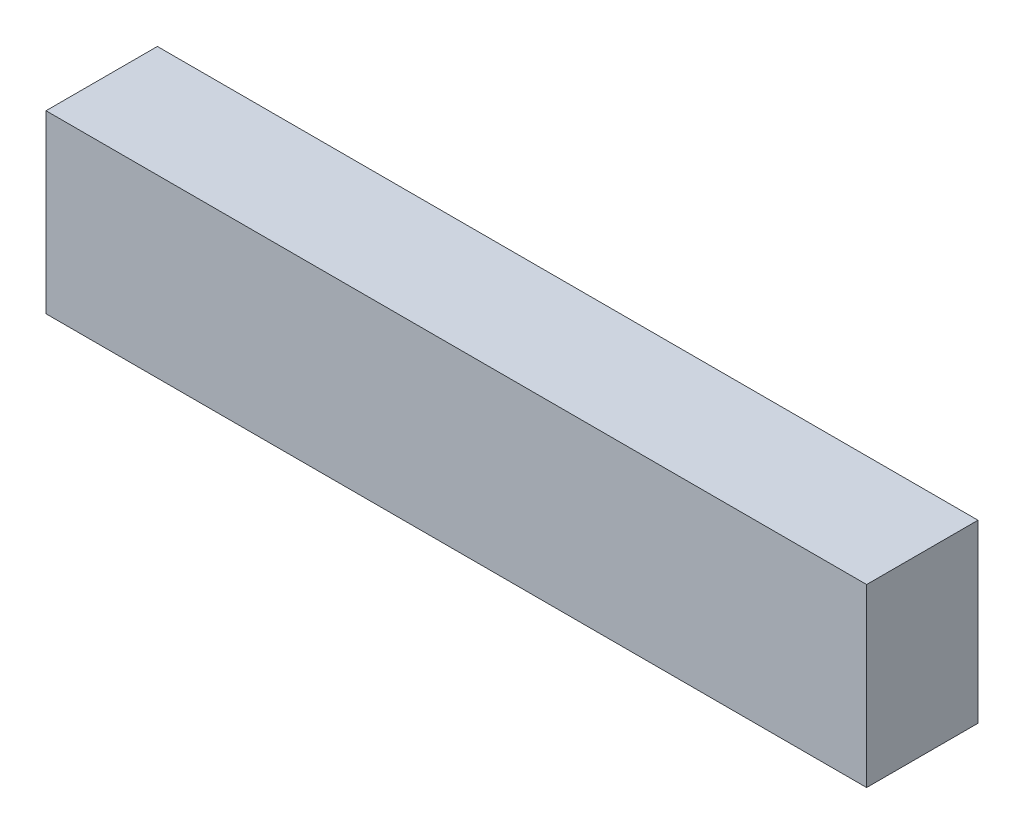
from build123d import *

# Parameters (mm, degrees)
SKETCH2_W           = 30
SKETCH2_H           = 140
BOSS_EXTRUDE1_DEPTH = 19


with BuildPart() as part:
    # Sketch2 → Boss-Extrude1 (new body)
    with BuildSketch(Plane(origin=(0, 0, 0), x_dir=(0, 1, 0), z_dir=(0, 0, 1))):
        Rectangle(SKETCH2_W, SKETCH2_H)
    extrude(amount=BOSS_EXTRUDE1_DEPTH)


solid = part.part
